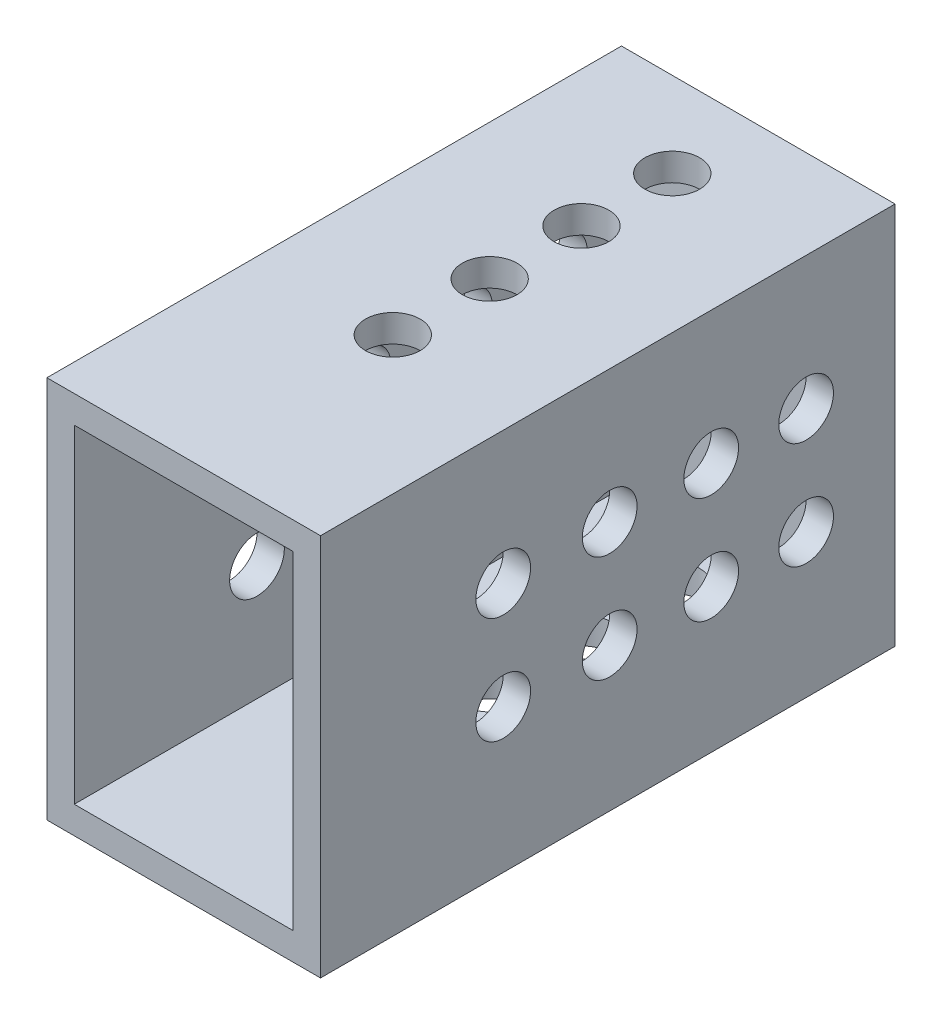
from build123d import *

# Parameters (mm, degrees)
ESQUISSE1_W             = 10
ESQUISSE1_H             = 14
BOSS_EXTRU_1_DEPTH      = 1
ESQUISSE2_W             = 10
ESQUISSE2_H             = 14
ESQUISSE2_W_2           = 8
ESQUISSE2_H_2           = 12
BOSS_EXTRU_2_DEPTH      = 20
ESQUISSE3_R             = 1
ENL_V_MAT_EXTRU_1_DEPTH = 44.02494538
ESQUISSE4_R             = 1
ENL_V_MAT_EXTRU_2_DEPTH = 53.662523212


with BuildPart() as part:
    # Esquisse1 → Boss.-Extru.1 (new body)
    with BuildSketch(Plane.XY):
        with Locations((-41.220572811, -29.195937962)):
            Rectangle(ESQUISSE1_W, ESQUISSE1_H)
    extrude(amount=BOSS_EXTRU_1_DEPTH)

    # Esquisse2 → Boss.-Extru.2 (add)
    with BuildSketch(Plane.XY.offset(1)):
        with Locations((-41.220572811, -29.195937962)):
            Rectangle(ESQUISSE2_W, ESQUISSE2_H)
        with Locations((-41.220572811, -29.195937962)):
            Rectangle(ESQUISSE2_W_2, ESQUISSE2_H_2, mode=Mode.SUBTRACT)
    extrude(amount=BOSS_EXTRU_2_DEPTH)

    # Esquisse3 → Enlèv. mat.-Extru.1 (cut, through all)
    with BuildSketch(Plane.ZY.offset(46.220572811)):
        with Locations(Location((3.252145139, -27.044676275, 0), (0, 0, 270))):
            Circle(ESQUISSE3_R)
        with Locations(Location((10.430913125, -27.044676275, 0), (0, 0, 270))):
            Circle(ESQUISSE3_R)
        with Locations(Location((6.720877569, -30.948290196, 0), (0, 0, 270))):
            Circle(ESQUISSE3_R)
        with Locations(Location((10.430913125, -30.948290196, 0), (0, 0, 270))):
            Circle(ESQUISSE3_R)
        with Locations(Location((14.321926026, -30.948290196, 0), (0, 0, 270))):
            Circle(ESQUISSE3_R)
        with Locations(Location((14.321926026, -27.044676275, 0), (0, 0, 270))):
            Circle(ESQUISSE3_R)
        with Locations(Location((6.720877569, -27.044676275, 0), (0, 0, 270))):
            Circle(ESQUISSE3_R)
        with Locations(Location((3.252145139, -30.948290196, 0), (0, 0, 270))):
            Circle(ESQUISSE3_R)
    extrude(amount=-ENL_V_MAT_EXTRU_1_DEPTH, mode=Mode.SUBTRACT)

    # Esquisse4 → Enlèv. mat.-Extru.2 (cut, through all)
    with BuildSketch(Plane(origin=(0, -22.195937962, 0), x_dir=(1, 0, 0), z_dir=(0, 1, 0))):
        with Locations(Location((-41.257446794, -3.10676642, 0), (0, 0, 270))):
            Circle(ESQUISSE4_R)
        with Locations(Location((-41.257446794, -6.425424885, 0), (0, 0, 270))):
            Circle(ESQUISSE4_R)
        with Locations(Location((-41.257446794, -9.780957333, 0), (0, 0, 270))):
            Circle(ESQUISSE4_R)
        with Locations(Location((-41.257446794, -13.320859695, 0), (0, 0, 270))):
            Circle(ESQUISSE4_R)
    extrude(amount=-ENL_V_MAT_EXTRU_2_DEPTH, mode=Mode.SUBTRACT)


solid = part.part
